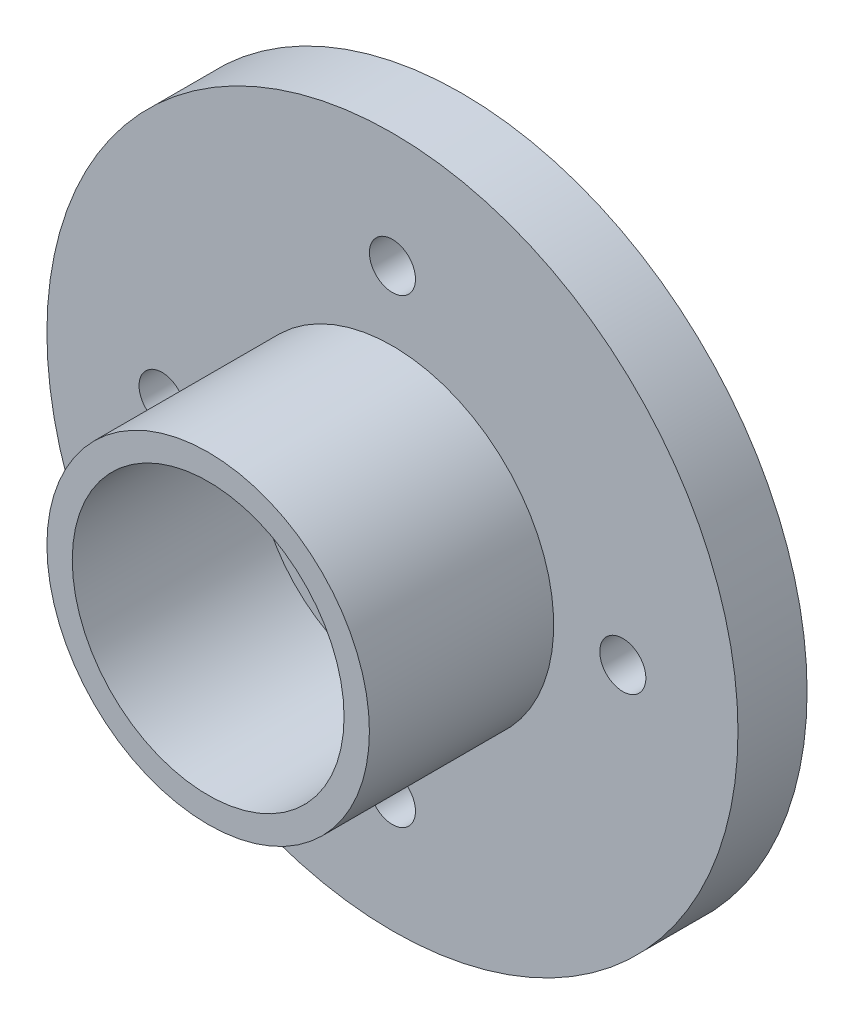
from build123d import *

# Parameters (mm, degrees)
ESQUISSE1_R             = 3.5
ESQUISSE1_R_2           = 2.95
BOSS_EXTRU_1_DEPTH      = 4
ESQUISSE2_R             = 7.5
BOSS_EXTRU_2_DEPTH      = 1.5
ESQUISSE3_R             = 0.5
ENL_V_MAT_EXTRU_3_DEPTH = 2


with BuildPart() as part:
    # Esquisse1 → Boss.-Extru.1 (new body)
    with BuildSketch(Plane.XY):
        Circle(ESQUISSE1_R)
        Circle(ESQUISSE1_R_2, mode=Mode.SUBTRACT)
    extrude(amount=BOSS_EXTRU_1_DEPTH)

    # Esquisse2 → Boss.-Extru.2 (add)
    with BuildSketch(Plane(origin=(0, 0, 0), x_dir=(-1, 0, 0), z_dir=(0, 0, -1))):
        Circle(ESQUISSE2_R)
    extrude(amount=BOSS_EXTRU_2_DEPTH)

    # Esquisse3 → Enlèv. mat.-Extru.3 (cut)
    with BuildSketch(Plane(origin=(0, 0, -1.5), x_dir=(-1, 0, 0), z_dir=(0, 0, -1))):
        with Locations((0, 5)):
            Circle(ESQUISSE3_R)
        with Locations((5, 0)):
            Circle(ESQUISSE3_R)
        with Locations((0, -5)):
            Circle(ESQUISSE3_R)
        with Locations((-5, 0)):
            Circle(ESQUISSE3_R)
    extrude(amount=-ENL_V_MAT_EXTRU_3_DEPTH, mode=Mode.SUBTRACT)


solid = part.part
